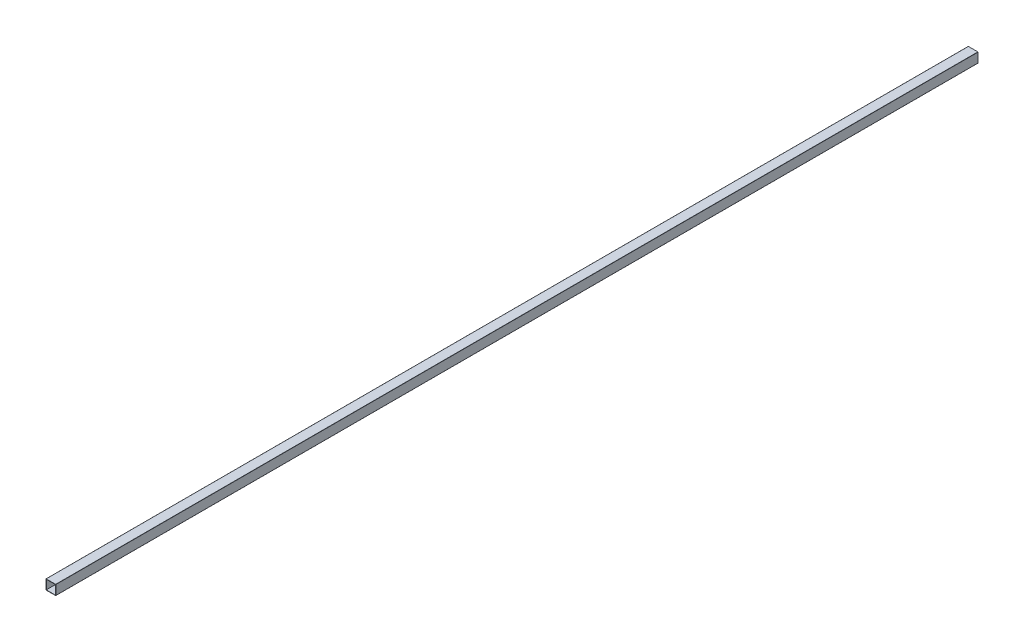
from build123d import *

# Parameters (mm, degrees)
CROQUIS1_W              = 59.72
CROQUIS1_H              = 59.72
SALIENTE_EXTRUIR1_DEPTH = 6000


with BuildPart() as part:
    # Croquis1 → Saliente-Extruir1 (new body)
    with BuildSketch(Plane.XY):
        with BuildLine():
            Line((-30.75, -31.75), (30.75, -31.75))
            ThreePointArc((30.75, -31.75), (31.457106781, -31.457106781), (31.75, -30.75))
            Line((31.75, -30.75), (31.75, 30.75))
            ThreePointArc((31.75, 30.75), (31.457106781, 31.457106781), (30.75, 31.75))
            Line((30.75, 31.75), (-30.75, 31.75))
            ThreePointArc((-30.75, 31.75), (-31.457106781, 31.457106781), (-31.75, 30.75))
            Line((-31.75, 30.75), (-31.75, -30.75))
            ThreePointArc((-31.75, -30.75), (-31.457106781, -31.457106781), (-30.75, -31.75))
        make_face()
        Rectangle(CROQUIS1_W, CROQUIS1_H, mode=Mode.SUBTRACT)
    extrude(amount=SALIENTE_EXTRUIR1_DEPTH)


solid = part.part
